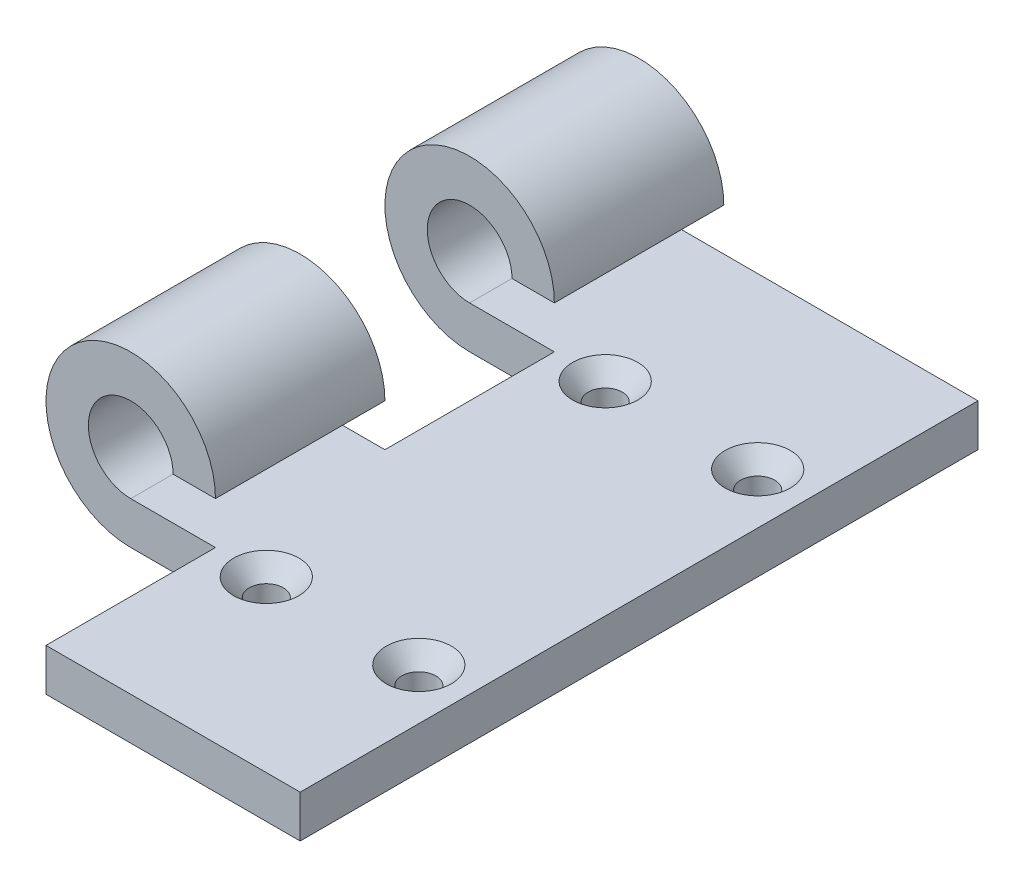
from build123d import *

# Parameters (mm, degrees)
EXTRUDE_THIN2_DEPTH                             = 50.8
SKETCH2_W                                       = 25.4
SKETCH2_H                                       = 25.4
CUT_EXTRUDE1_DEPTH                              = 84.521209881
LPATTERN1_COUNT                                 = 2
LPATTERN1_PITCH                                 = 50.8
CSK_FOR_10_FLAT_HEAD_MACHINE_SCREW1_D           = 5.1054
CSK_FOR_10_FLAT_HEAD_MACHINE_SCREW1_CSINK_D     = 9.779
CSK_FOR_10_FLAT_HEAD_MACHINE_SCREW1_CSINK_ANGLE = 82
LPATTERN2_COUNT                                 = 2
LPATTERN2_PITCH                                 = 50.8
LPATTERN2_COUNT_DIR2                            = 2
LPATTERN2_PITCH_DIR2                            = 22.86


with BuildPart() as part:
    # Sketch1 → Extrude-Thin2 (new, symmetric)
    with BuildSketch(Plane.XY):
        with BuildLine():
            Line((0, 0), (-50.8, 0))
            ThreePointArc((-50.8, 0), (-59.780256121, 21.680256121), (-38.1, 12.7))
            Line((-38.1, 12.7), (-44.45, 12.7))
            ThreePointArc((-44.45, 12.7), (-55.290128061, 17.190128061), (-50.8, 6.35))
            Line((-50.8, 6.35), (0, 6.35))
            Line((0, 6.35), (0, 0))
        make_face()
    extrude(amount=EXTRUDE_THIN2_DEPTH, both=True)

    # Sketch2 → Cut-Extrude1 (cut, symmetric)
    with BuildSketch(Plane(origin=(0, 6.35, 0), x_dir=(1, 0, 0), z_dir=(0, 1, 0))):
        with Locations((-50.8, -38.1)):
            Rectangle(SKETCH2_W, SKETCH2_H)
    cut_extrude1 = extrude(amount=CUT_EXTRUDE1_DEPTH, both=True, mode=Mode.SUBTRACT)

    # LPattern1: Cut-Extrude1 ×2
    with Locations(*[(0, 0, -i * LPATTERN1_PITCH) for i in range(1, LPATTERN1_COUNT)]):
        add(cut_extrude1, mode=Mode.SUBTRACT)

    # CSK for #10 Flat Head Machine Screw1 (through all)
    with Locations(Plane(origin=(0, 6.35, 0), x_dir=(1, 0, 0), z_dir=(0, 1, 0))):
        with Locations((-30.48, 25.4)):
            csk_for_10_flat_head_machine_screw1 = CounterSinkHole(CSK_FOR_10_FLAT_HEAD_MACHINE_SCREW1_D / 2, CSK_FOR_10_FLAT_HEAD_MACHINE_SCREW1_CSINK_D / 2, counter_sink_angle=CSK_FOR_10_FLAT_HEAD_MACHINE_SCREW1_CSINK_ANGLE)

    # LPattern2: CSK for _10 Flat Head Machine Screw1 2 × 2
    with Locations(*[(j * LPATTERN2_PITCH_DIR2, 0, i * LPATTERN2_PITCH) for i in range(LPATTERN2_COUNT) for j in range(LPATTERN2_COUNT_DIR2) if (i, j) != (0, 0)]):
        add(csk_for_10_flat_head_machine_screw1, mode=Mode.SUBTRACT)


solid = part.part
